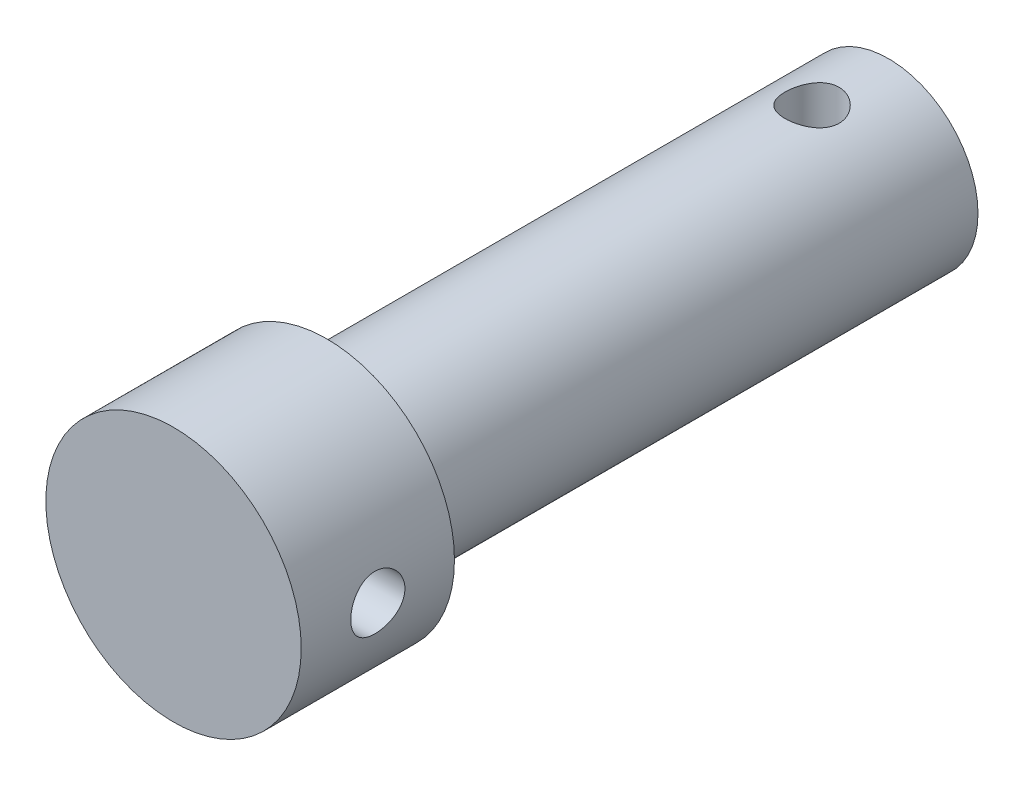
from build123d import *

# Parameters (mm, degrees)
SKETCH1_R               = 11.1125
SKETCH1_R_2             = 5.08
BOSS_EXTRUDE1_DEPTH     = 88.9
SKETCH4_R               = 15.875
BOSS_EXTRUDE2_DEPTH     = 19.05
CUT_EXTRUDE1_DEPTH      = 92.691009647
CUT_EXTRUDE1_DEPTH_BACK = 92.691009647
SKETCH5_R               = 3.3655
CUT_EXTRUDE2_DEPTH      = 92.691009778
CUT_EXTRUDE2_DEPTH_BACK = 92.691009778
SKETCH7_R               = 3.3655


with BuildPart() as part:
    # Sketch1 → Boss-Extrude1 (new body)
    with BuildSketch(Plane.XY):
        Circle(SKETCH1_R)
        Circle(SKETCH1_R_2, mode=Mode.SUBTRACT)
    extrude(amount=BOSS_EXTRUDE1_DEPTH)

    # Sketch4 → Boss-Extrude2 (add)
    with BuildSketch(Plane.XY.offset(88.9)):
        Circle(SKETCH4_R)
    extrude(amount=-BOSS_EXTRUDE2_DEPTH)

    # Sketch5 → Cut-Extrude1 (cut, two sides: drawn at the far end of the back side and taken through both)
    with BuildSketch(Plane(origin=(0, 0, 0), x_dir=(0, 0, -1), z_dir=(1, 0, 0)).offset(-CUT_EXTRUDE1_DEPTH_BACK)):
        with Locations((-79.375, 0)):
            Circle(SKETCH5_R)
    extrude(amount=CUT_EXTRUDE1_DEPTH + CUT_EXTRUDE1_DEPTH_BACK, mode=Mode.SUBTRACT)

    # Sketch7 → Cut-Extrude2 (cut, two sides: drawn at the far end of the back side and taken through both)
    with BuildSketch(Plane(origin=(0, 0, 0), x_dir=(1, 0, 0), z_dir=(0, 1, 0)).offset(-CUT_EXTRUDE2_DEPTH_BACK)):
        with Locations(Location((0, -9.525, 0), (0, 0, 270))):
            Circle(SKETCH7_R)
    extrude(amount=CUT_EXTRUDE2_DEPTH + CUT_EXTRUDE2_DEPTH_BACK, mode=Mode.SUBTRACT)


solid = part.part
